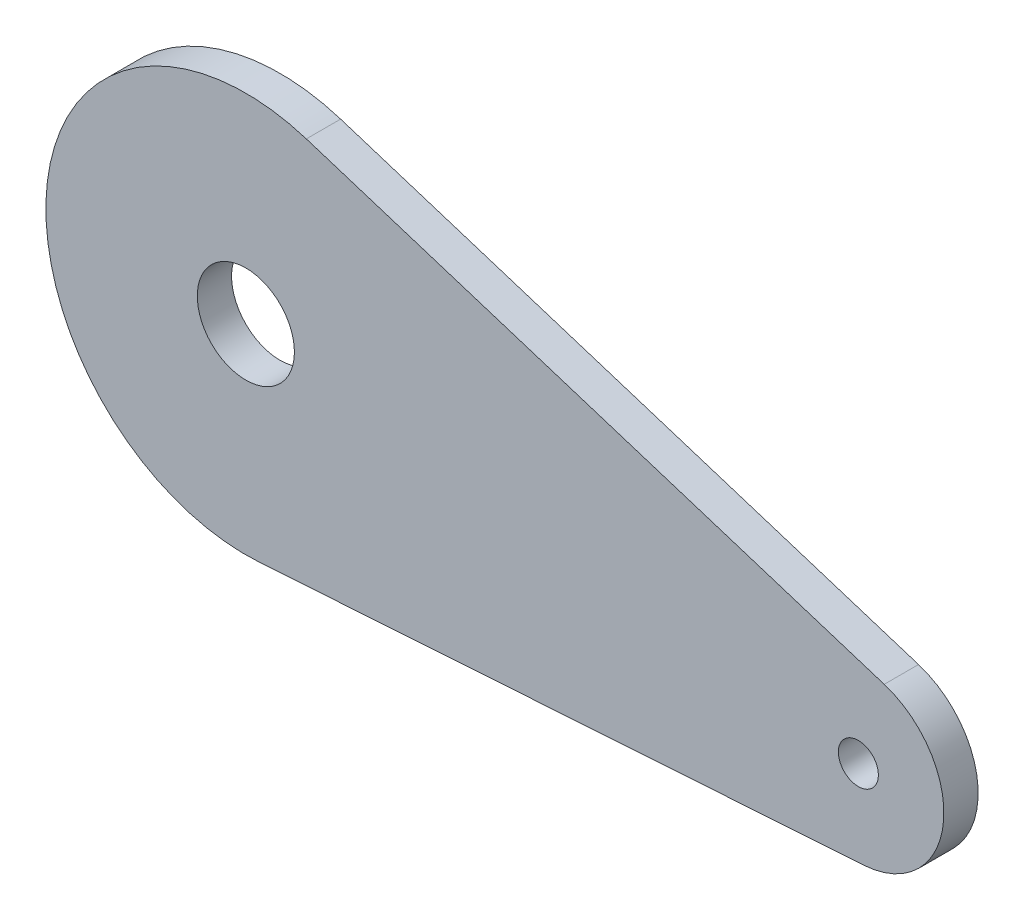
from build123d import *

# Parameters (mm, degrees)
SKETCH1_R           = 1.75
SKETCH1_R_2         = 4.25
BOSS_EXTRUDE1_DEPTH = 3


with BuildPart() as part:
    # Sketch1 → Boss-Extrude1 (new body)
    with BuildSketch(Plane.XY):
        with BuildLine():
            Line((-14.926145808, 74.260081169), (35.650831913, 58.208172139))
            ThreePointArc((35.650831913, 58.208172139), (40.816869698, 50.172360282), (33.878610609, 43.60556659))
            Line((33.878610609, 43.60556659), (-19.069762715, 40.117842224))
            ThreePointArc((-19.069762715, 40.117842224), (-37.592527127, 59.6883883), (-14.926145808, 74.260081169))
        make_face()
        with Locations((33.386655135, 51.074116103)):
            Circle(SKETCH1_R, mode=Mode.SUBTRACT)
        with Locations((-20.22, 57.58)):
            Circle(SKETCH1_R_2, mode=Mode.SUBTRACT)
    extrude(amount=-BOSS_EXTRUDE1_DEPTH)


solid = part.part
